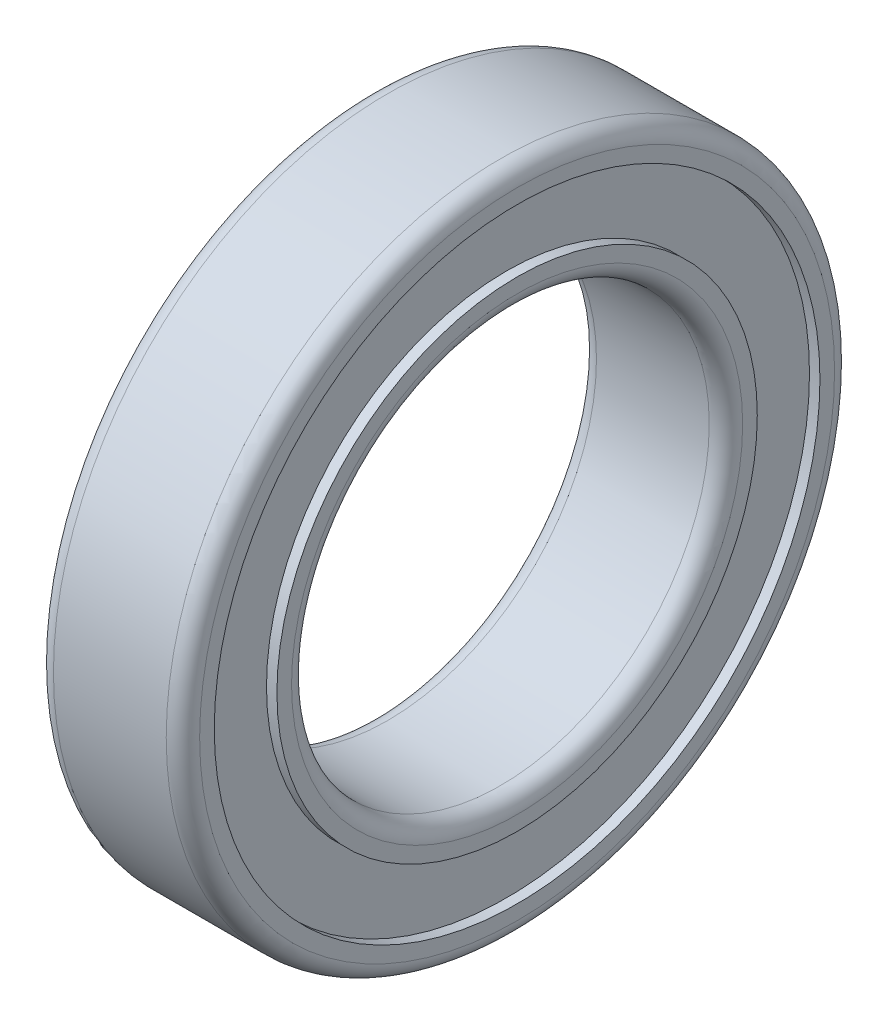
from build123d import *

# Parameters (mm, degrees)
FILLET_1_R = 0.8


with BuildPart() as part:
    # Эскиз1 → Повернуть1 (revolve)
    with BuildSketch(Plane.XY, mode=Mode.PRIVATE) as revolve_1_sk:
        Polygon((3.5, 10), (-3.5, 10), (-3.5, 11.5), (-3, 11.5), (-3, 14.5), (-3.5, 14.5), (-3.5, 16), (3.5, 16), (3.5, 14.5), (3, 14.5), (3, 11.5), (3.5, 11.5), align=None)
    revolve(revolve_1_sk.sketch.rotate(Axis((0, 0, 0), (-1, 0, 0)), 90), axis=Axis((0, 0, 0), (-1, 0, 0)))

    # Скругление1
    fillet_1_edges = [part.edges().sort_by_distance(p)[0] for p in [
        (-3.5, 0, 16),
        (3.5, 0, 16),
        (3.5, 0, 10),
        (-3.5, 0, 10),
    ]]
    fillet(fillet_1_edges, radius=FILLET_1_R)


solid = part.part
